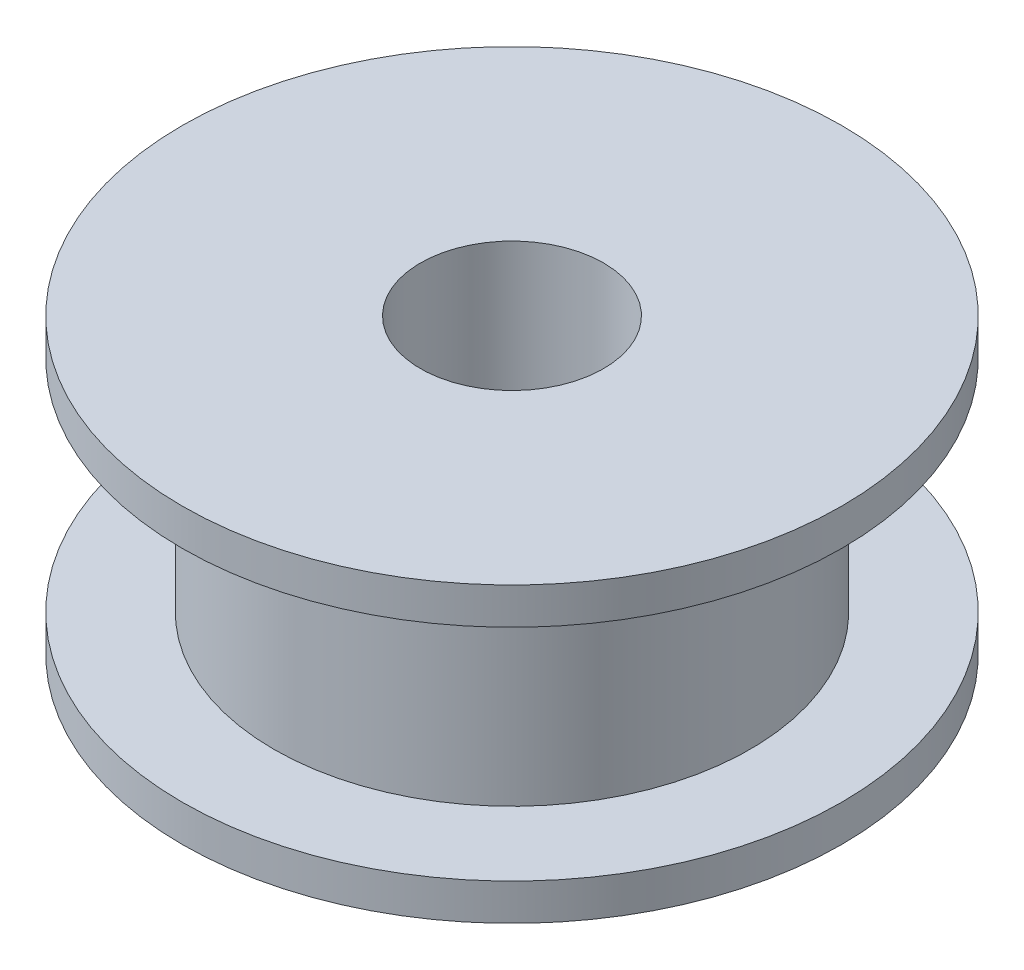
from build123d import *


with BuildPart() as part:
    # Sketch1 → Revolve1 (revolve)
    with BuildSketch(Plane.XY, mode=Mode.PRIVATE) as revolve1_sk:
        Polygon((2.5, 0), (2.5, 8), (9, 8), (9, 7), (6.5, 7), (6.5, 1), (9, 1), (9, 0), align=None)
    revolve(revolve1_sk.sketch.rotate(Axis((0, 0, 0), (0, 1, 0)), 90), axis=Axis((0, 0, 0), (0, 1, 0)))


solid = part.part
